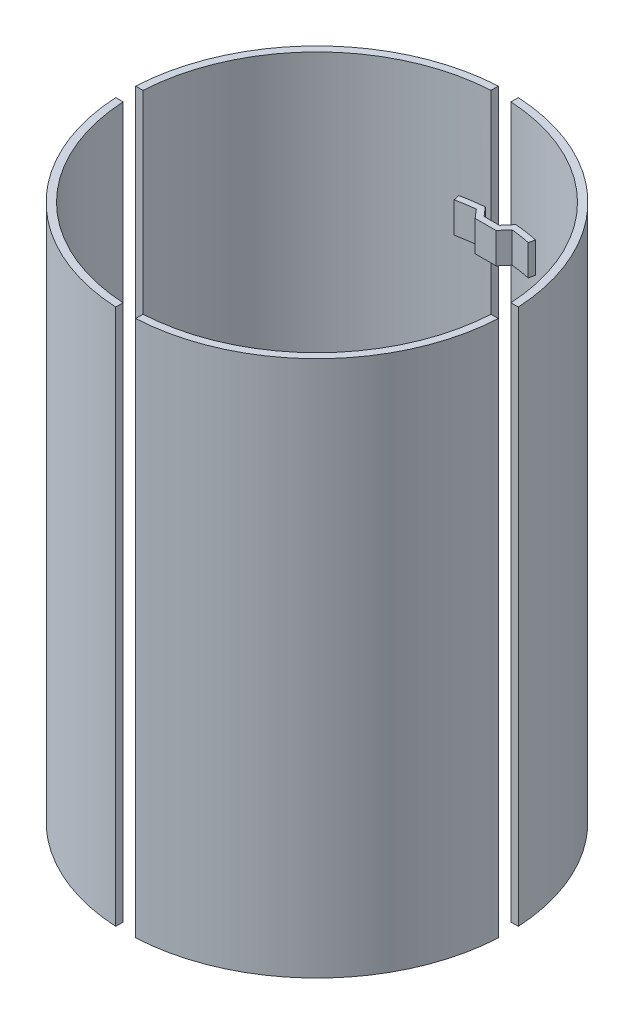
from build123d import *

# Parameters (mm, degrees)
SKETCH1_R           = 62.5
SKETCH1_R_2         = 60.1
BOSS_EXTRUDE1_DEPTH = 87.5
SKETCH2_W           = 6.5
SKETCH2_H           = 2.487938712
CUT_EXTRUDE1_DEPTH  = 197.054839267
CIRPATTERN1_COUNT   = 4
EXTRUDE_THIN1_DEPTH = 10


with BuildPart() as part:
    # Sketch1 → Boss-Extrude1 (new, symmetric)
    with BuildSketch(Plane(origin=(0, 0, 0), x_dir=(1, 0, 0), z_dir=(0, 1, 0))):
        with Locations(Location((0, 0, 0), (0, 0, 270))):
            Circle(SKETCH1_R)
        with Locations(Location((0, 0, 0), (0, 0, 270))):
            Circle(SKETCH1_R_2, mode=Mode.SUBTRACT)
    extrude(amount=BOSS_EXTRUDE1_DEPTH, both=True)

    # Sketch2 → Cut-Extrude1 (cut, through all)
    with BuildSketch(Plane(origin=(0, 87.5, 0), x_dir=(1, 0, 0), z_dir=(0, 1, 0))):
        with Locations((0, 61.256030644)):
            Rectangle(SKETCH2_W, SKETCH2_H)
    cut_extrude1 = extrude(amount=-CUT_EXTRUDE1_DEPTH, mode=Mode.SUBTRACT)

    # CirPattern1: Cut-Extrude1 ×4 about axis
    cirpattern1_axis = Axis((0, 0, 0), (0, 1, 0))
    for i in range(1, CIRPATTERN1_COUNT):
        add(cut_extrude1.rotate(cirpattern1_axis, i * 360 / CIRPATTERN1_COUNT), mode=Mode.SUBTRACT)

    # Sketch3 → Extrude-Thin1 (add)
    with BuildSketch(Plane(origin=(0, 43.75, 0), x_dir=(1, 0, 0), z_dir=(0, 1, 0))):
        with BuildLine():
            ThreePointArc((-12.5, 58.78571255), (-8.767455481, 59.457057818), (-5, 59.891652173))
            Line((-5, 59.891652173), (-2.5, 57))
            Line((-2.5, 57), (2.5, 57))
            Line((2.5, 57), (5, 59.891652173))
            ThreePointArc((5, 59.891652173), (8.767455481, 59.457057818), (12.5, 58.78571255))
            Line((12.5, 58.78571255), (12.084026622, 56.829449237))
            ThreePointArc((12.084026622, 56.829449237), (8.975501228, 57.402529367), (5.840409558, 57.805705741))
            Line((5.840409558, 57.805705741), (3.414715203, 55))
            Line((3.414715203, 55), (-3.414715203, 55))
            Line((-3.414715203, 55), (-5.840409558, 57.805705741))
            ThreePointArc((-5.840409558, 57.805705741), (-8.975501228, 57.402529367), (-12.084026622, 56.829449237))
            Line((-12.084026622, 56.829449237), (-12.5, 58.78571255))
        make_face()
    extrude(amount=EXTRUDE_THIN1_DEPTH)


solid = part.part
